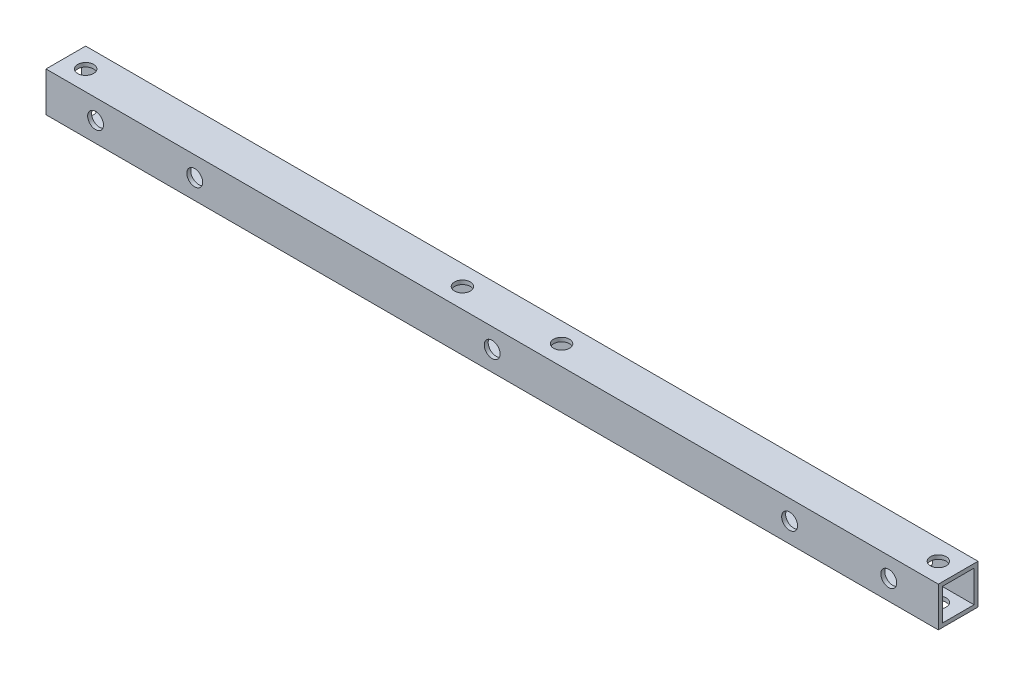
from build123d import *

# Parameters (mm, degrees)
SKETCH_1_W          = 10
SKETCH_1_H          = 10
SKETCH_1_W_2        = 8
SKETCH_1_H_2        = 8
EXTRUDE_1_DEPTH     = 225
SKETCH_2_R          = 2
CUT_EXTRUDE_1_DEPTH = 226.277606521
SKETCH_3_R          = 2
CUT_EXTRUDE_2_DEPTH = 226.277606521


with BuildPart() as part:
    # ｽｹｯﾁ1 → 押し出し-薄板1 (new body)
    with BuildSketch(Plane(origin=(0, 0, 0), x_dir=(0, 0, -1), z_dir=(1, 0, 0))):
        Rectangle(SKETCH_1_W, SKETCH_1_H)
        Rectangle(SKETCH_1_W_2, SKETCH_1_H_2, mode=Mode.SUBTRACT)
    extrude(amount=EXTRUDE_1_DEPTH)

    # ｽｹｯﾁ2 → ｶｯﾄ - 押し出し1 (cut, through all)
    with BuildSketch(Plane.XY.offset(5)):
        with Locations((37.5, 0)):
            Circle(SKETCH_2_R)
        with Locations(Location((187.5, 0, 0), (0, 0, 90))):
            Circle(SKETCH_2_R)
        with Locations((112.5, 0)):
            Circle(SKETCH_2_R)
        with Locations((12.5, 0)):
            Circle(SKETCH_2_R)
        with Locations(Location((212.5, 0, 0), (0, 0, 90))):
            Circle(SKETCH_2_R)
    extrude(amount=-CUT_EXTRUDE_1_DEPTH, mode=Mode.SUBTRACT)

    # ｽｹｯﾁ3 → ｶｯﾄ - 押し出し2 (cut, through all)
    with BuildSketch(Plane(origin=(0, 5, 0), x_dir=(1, 0, 0), z_dir=(0, 1, 0))):
        with Locations(Location((5, 0, 0), (0, 0, 270))):
            Circle(SKETCH_3_R)
        with Locations(Location((220, 0, 0), (0, 0, 270))):
            Circle(SKETCH_3_R)
        with Locations(Location((100, 0, 0), (0, 0, 270))):
            Circle(SKETCH_3_R)
        with Locations(Location((125, 0, 0), (0, 0, 270))):
            Circle(SKETCH_3_R)
    extrude(amount=-CUT_EXTRUDE_2_DEPTH, mode=Mode.SUBTRACT)


solid = part.part
